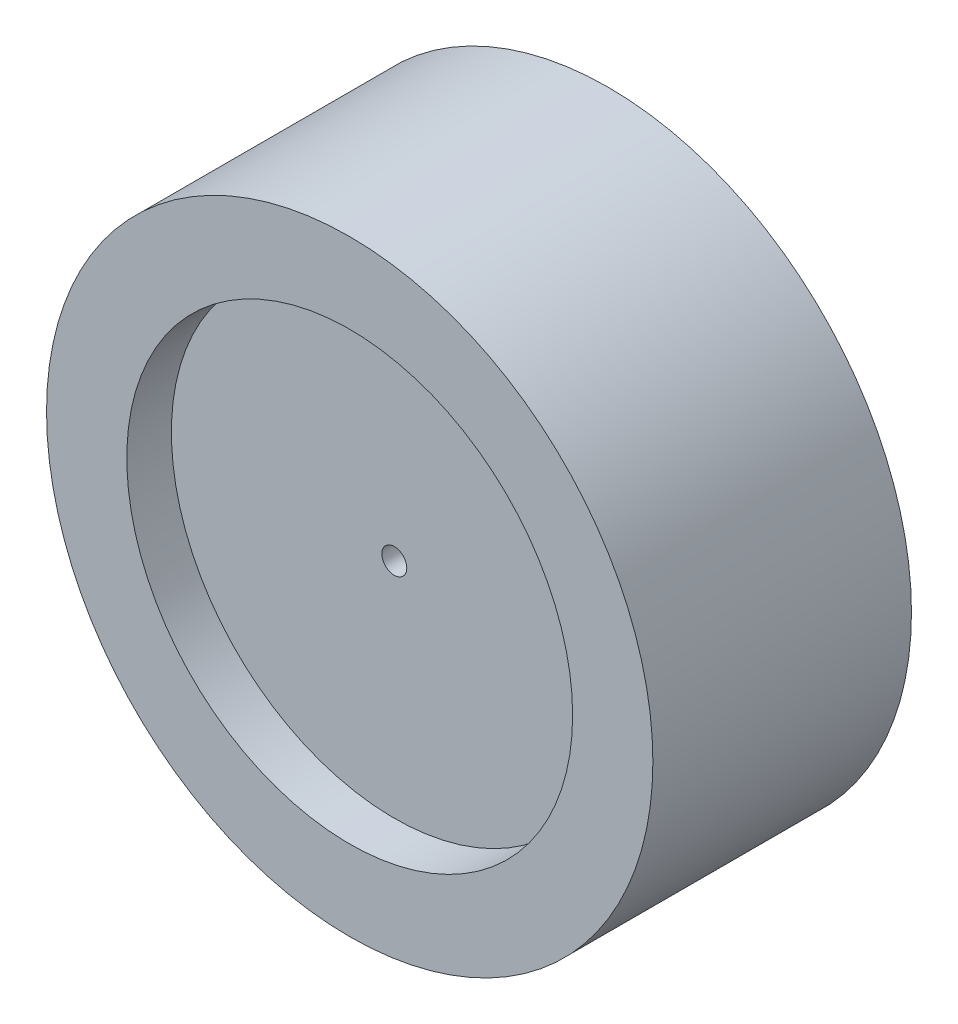
from build123d import *

# Parameters (mm, degrees)
SKETCH_1_R          = 34
EXTRUDE_1_DEPTH     = 29
SKETCH_2_R          = 25
CUT_EXTRUDE_1_DEPTH = 5
CUT_EXTRUDE_START   = -5
SKETCH_3_R          = 25
CUT_EXTRUDE_2_DEPTH = 5
CUT_EXTRUDE_3_DEPTH = 10
SKETCH_5_R          = 1.4
CUT_EXTRUDE_4_DEPTH = 54.74011537


with BuildPart() as part:
    # 草图1 → 凸台-拉伸1 (new body)
    with BuildSketch(Plane.XY):
        with Locations(Location((0, 0, 0), (0, 0, 180))):
            Circle(SKETCH_1_R)
    extrude(amount=EXTRUDE_1_DEPTH)

    # 草图2 → 切除-拉伸1 (cut)
    with BuildSketch(Plane.XY.offset(29)):
        Circle(SKETCH_2_R)
    extrude(amount=-CUT_EXTRUDE_1_DEPTH, mode=Mode.SUBTRACT)

    # 草图3 → 切除-拉伸2 (cut)
    with BuildSketch(Plane(origin=(0, 0, 0), x_dir=(-1, 0, 0), z_dir=(0, 0, -1)).offset(CUT_EXTRUDE_START)):
        with Locations(Location((0, 0, 0), (0, 0, 180))):
            Circle(SKETCH_3_R)
    extrude(amount=CUT_EXTRUDE_2_DEPTH, mode=Mode.SUBTRACT)

    # 草图4 → 切除-拉伸3 (cut)
    with BuildSketch(Plane(origin=(0, 0, 5), x_dir=(-1, 0, 0), z_dir=(0, 0, -1))):
        Polygon((2.352778868, -3.142891174), (3.898213032, 0.466120682), (1.545434164, 3.609011856), (-2.352778868, 3.142891174), (-3.898213032, -0.466120682), (-1.545434164, -3.609011856), align=None)
    extrude(amount=-CUT_EXTRUDE_3_DEPTH, mode=Mode.SUBTRACT)

    # 草图5 → 切除-拉伸4 (cut, through all)
    with BuildSketch(Plane.XY.offset(24)):
        Circle(SKETCH_5_R)
    extrude(amount=-CUT_EXTRUDE_4_DEPTH, mode=Mode.SUBTRACT)


solid = part.part
